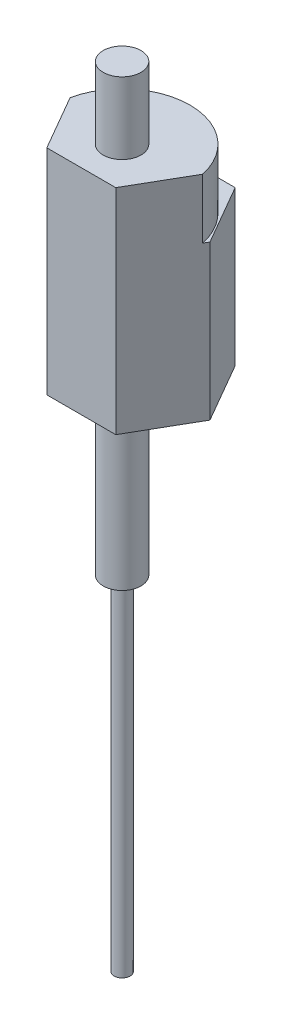
from build123d import *

# Parameters (mm, degrees)
BOSS_EXTRUDE1_DEPTH = 21.5
SKETCH2_R           = 1.9
BOSS_EXTRUDE2_DEPTH = 7.2
CUT_EXTRUDE1_DEPTH  = 6
BOSS_EXTRUDE3_START = 16
SKETCH4_R           = 1.9
BOSS_EXTRUDE3_DEPTH = 16
SKETCH5_R           = 0.8
SKETCH5_R_2         = 0.654757234
BOSS_EXTRUDE4_DEPTH = 34.5


with BuildPart() as part:
    # Sketch1 → Boss-Extrude1 (new body)
    with BuildSketch(Plane(origin=(0, 0, 0), x_dir=(1, 0, 0), z_dir=(0, 1, 0))):
        Polygon((-6.92820323, 0), (-3.464101615, -6), (3.464101615, -6), (6.92820323, 0), (3.464101615, 6), (-3.464101615, 6), align=None)
    extrude(amount=BOSS_EXTRUDE1_DEPTH)

    # Sketch2 → Boss-Extrude2 (add)
    with BuildSketch(Plane(origin=(0, 21.5, 0), x_dir=(1, 0, 0), z_dir=(0, 1, 0))):
        with Locations(Location((0, -1.9, 0), (0, 0, 270))):
            Circle(SKETCH2_R)
    extrude(amount=BOSS_EXTRUDE2_DEPTH)

    # Sketch3 → Cut-Extrude1 (cut)
    with BuildSketch(Plane(origin=(0, 21.5, 0), x_dir=(1, 0, 0), z_dir=(0, 1, 0))):
        with BuildLine():
            Line((-6.661546125, -0.461863655), (-6.92820323, 0))
            Line((-6.92820323, 0), (-3.464101615, 6))
            Line((-3.464101615, 6), (3.464101615, 6))
            Line((3.464101615, 6), (6.92820323, 0))
            Line((6.92820323, 0), (6.661546125, -0.461863655))
            ThreePointArc((6.661546125, -0.461863655), (0, 4.915015255), (-6.661546125, -0.461863655))
        make_face()
    extrude(amount=-CUT_EXTRUDE1_DEPTH, mode=Mode.SUBTRACT)

    # Sketch4 → Boss-Extrude3 (add)
    with BuildSketch(Plane.XZ.offset(BOSS_EXTRUDE3_START)):
        with Locations(Location((0, 1.9, 0), (0, 0, 90))):
            Circle(SKETCH4_R)
    extrude(amount=-BOSS_EXTRUDE3_DEPTH)

    # Sketch5 → Boss-Extrude4 (add)
    with BuildSketch(Plane.XZ.offset(16)):
        with Locations(Location((0, 1.9, 0), (0, 0, 270))):
            Circle(SKETCH5_R)
        with Locations(Location((0, 1.9, 0), (0, 0, 270))):
            Circle(SKETCH5_R_2, mode=Mode.SUBTRACT)
    extrude(amount=BOSS_EXTRUDE4_DEPTH)


solid = part.part
